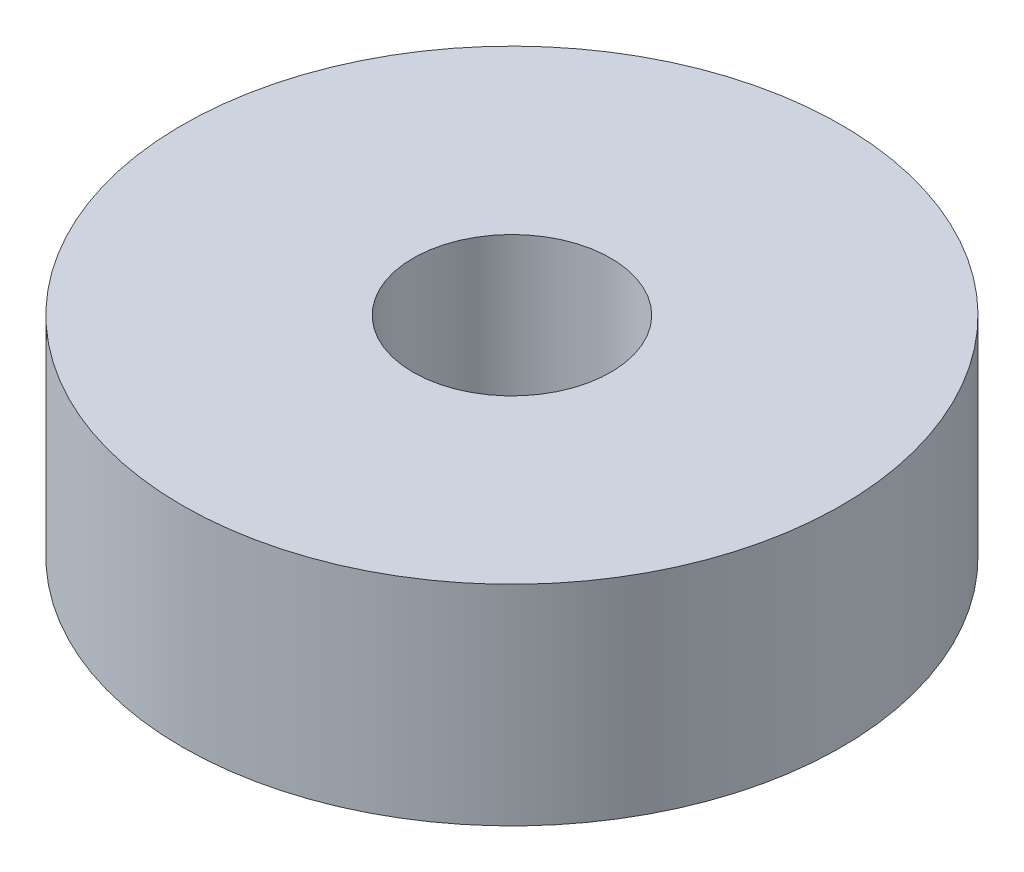
from build123d import *

# Parameters (mm, degrees)
SKETCH2_R           = 5
SKETCH2_R_2         = 1.5
BOSS_EXTRUDE1_DEPTH = 3.175


with BuildPart() as part:
    # Sketch2 → Boss-Extrude1 (new body)
    with BuildSketch(Plane(origin=(0, 0, 0), x_dir=(1, 0, 0), z_dir=(0, 1, 0))):
        with Locations(Location((36.289260584, 78.276137226, 0), (0, 0, 270))):
            Circle(SKETCH2_R)
        with Locations(Location((36.289260584, 78.276137226, 0), (0, 0, 270))):
            Circle(SKETCH2_R_2, mode=Mode.SUBTRACT)
    extrude(amount=BOSS_EXTRUDE1_DEPTH)


solid = part.part
